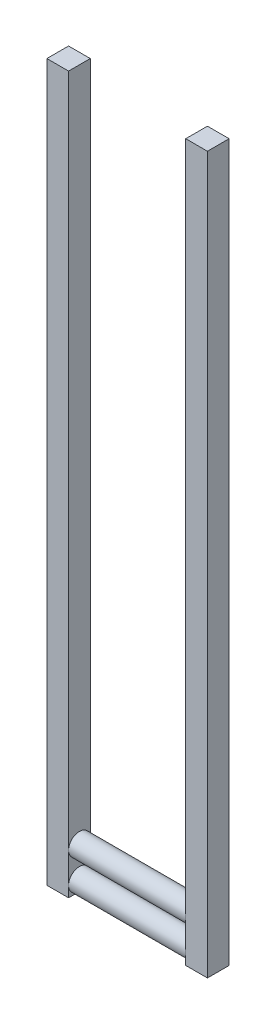
from build123d import *

# Parameters (mm, degrees)
SKETCH_1_W        = 5
SKETCH_1_H        = 5
EXTRUDE_2_DEPTH   = 165
EXTRUDE_2_2_DEPTH = 165
SKETCH_2_R        = 2.5
EXTRUDE_3_DEPTH   = 27


with BuildPart() as part:
    # ｽｹｯﾁ1 → ﾎﾞｽ - 押し出し2 (new body)
    with BuildSketch(Plane(origin=(0, 0, 0), x_dir=(1, 0, 0), z_dir=(0, 1, 0))):
        with Locations((-18.035714286, 2.5)):
            Rectangle(SKETCH_1_W, SKETCH_1_H)
    extrude(amount=-EXTRUDE_2_DEPTH)



with BuildPart() as body_2:
    # ｽｹｯﾁ1 → Extrude 2 2 (new body)
    with BuildSketch(Plane(origin=(0, 0, 0), x_dir=(1, 0, 0), z_dir=(0, 1, 0))):
        with Locations((13.964285714, 2.5)):
            Rectangle(SKETCH_1_W, SKETCH_1_H)
    extrude(amount=-EXTRUDE_2_2_DEPTH)


with BuildPart() as part_1:
    add(part.part)

    add(body_2.part)  # ﾎﾞｽ - 押し出し3 merges body 2
    # ｽｹｯﾁ2 → ﾎﾞｽ - 押し出し3 (add)
    with BuildSketch(Plane(origin=(-15.535714286, 0, 0), x_dir=(0, 0, -1), z_dir=(1, 0, 0))):
        with Locations(Location((2.5, -162.5, 0), (0, 0, 180))):
            Circle(SKETCH_2_R)
        with Locations(Location((2.5, -155.5, 0), (0, 0, 180))):
            Circle(SKETCH_2_R)
    extrude(amount=EXTRUDE_3_DEPTH)


solid = part_1.part
